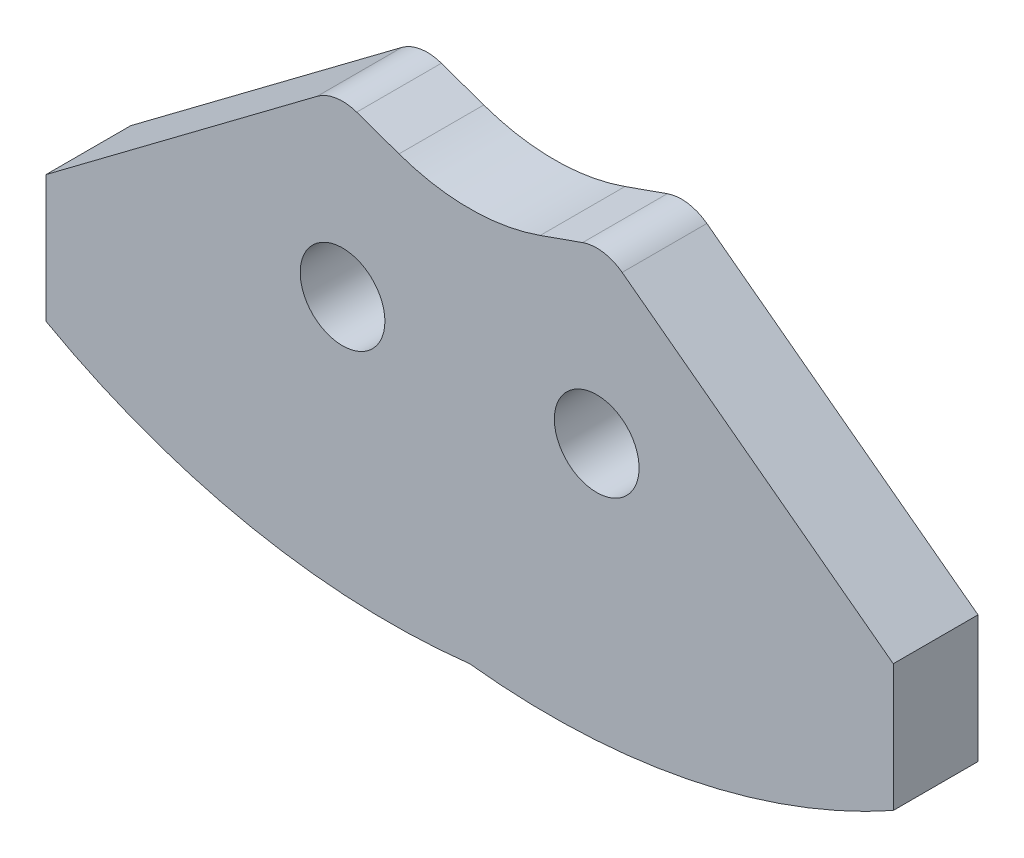
from build123d import *

# Parameters (mm, degrees)
SZKIC1_R                    = 5
DODANIE_WYCI_GNI_CIE1_DEPTH = 10


with BuildPart() as part:
    # Szkic1 → Dodanie-wyciągnięcie1 (new body)
    with BuildSketch(Plane.XY):
        with BuildLine():
            Line((0, 10), (0, 25))
            Line((0, 25), (31.999991312, 49.000008999))
            ThreePointArc((31.999991312, 49.000008999), (34.24374996, 49.942489803), (36.666669828, 49.714055442))
            Line((36.666669828, 49.714055442), (41.666653651, 47.946291102))
            ThreePointArc((41.666653651, 47.946291102), (50, 46.51651254), (58.333346349, 47.946291102))
            Line((58.333346349, 47.946291102), (63.333330172, 49.714055442))
            ThreePointArc((63.333330172, 49.714055442), (65.75625004, 49.942489803), (68.000008688, 49.000008999))
            Line((68.000008688, 49.000008999), (100, 25))
            Line((100, 25), (100, 10))
            ThreePointArc((100, 10), (75.784613824, 1.076930879), (50, 0))
            ThreePointArc((50, 0), (24.215386176, 1.076930879), (0, 10))
        make_face()
        with Locations((35, 30)):
            Circle(SZKIC1_R, mode=Mode.SUBTRACT)
        with Locations(Location((65, 30, 0), (0, 0, 180))):
            Circle(SZKIC1_R, mode=Mode.SUBTRACT)
    extrude(amount=DODANIE_WYCI_GNI_CIE1_DEPTH)


solid = part.part
